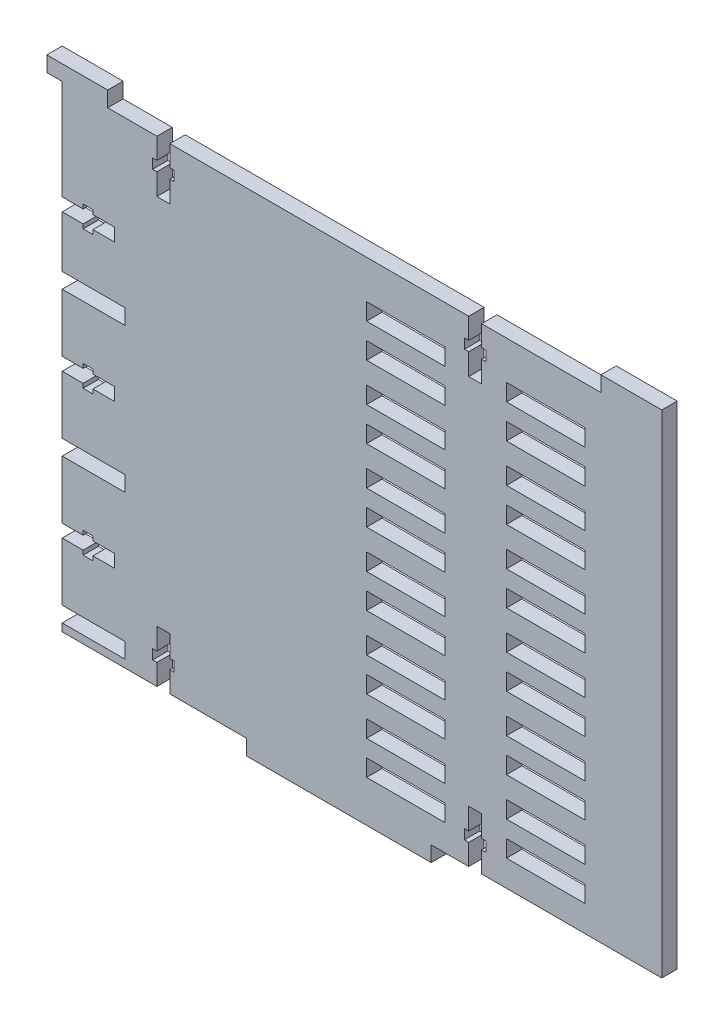
from build123d import *

# Parameters (mm, degrees)
SKETCH1_W           = 25.5
SKETCH1_H           = 5.5
BOSS_EXTRUDE1_DEPTH = 5
CUT_EXTRUDE3_DEPTH  = 10
SKETCH5_W           = 60
SKETCH5_H           = 5
BOSS_EXTRUDE2_DEPTH = 5
SKETCH6_W           = 20.4
SKETCH6_H           = 5
CUT_EXTRUDE4_DEPTH  = 10


with BuildPart() as part:
    # Sketch1 → Boss-Extrude1 (new body)
    with BuildSketch(Plane.XY):
        Polygon((-155.2, 151.5), (-155.2, 146.5), (5.2, 146.5), (5.2, 151.5), (25, 151.5), (25, -8.5), (-170, -8.5), (-170, -6), (-150, -6), (-150, -1), (-170, -1), (-170, 17.9), (-163.2, 17.9), (-163.2, 16.5), (-160, 16.5), (-160, 17.9), (-153, 17.9), (-153, 22.1), (-160, 22.1), (-160, 23.5), (-163.2, 23.5), (-163.2, 22.1), (-170, 22.1), (-170, 41), (-150, 41), (-150, 46), (-170, 46), (-170, 64.9), (-163.2, 64.9), (-163.2, 63.5), (-160, 63.5), (-160, 64.9), (-153, 64.9), (-153, 69.1), (-160, 69.1), (-160, 70.5), (-163.2, 70.5), (-163.2, 69.1), (-170, 69.1), (-170, 88), (-150, 88), (-150, 93), (-170, 93), (-170, 109.8), (-163.2, 109.8), (-163.2, 108.4), (-160, 108.4), (-160, 109.8), (-153, 109.8), (-153, 114), (-160, 114), (-160, 115.4), (-163.2, 115.4), (-163.2, 114), (-170, 114), (-170, 146.5), (-175, 146.5), (-175, 151.5), align=None)
        with Locations((-58.25, 13.75)):
            Rectangle(SKETCH1_W, SKETCH1_H, mode=Mode.SUBTRACT)
        with Locations((-12.75, 2.75)):
            Rectangle(SKETCH1_W, SKETCH1_H, mode=Mode.SUBTRACT)
        with Locations((-58.25, 2.75)):
            Rectangle(SKETCH1_W, SKETCH1_H, mode=Mode.SUBTRACT)
        with Locations((-12.75, 13.75)):
            Rectangle(SKETCH1_W, SKETCH1_H, mode=Mode.SUBTRACT)
        with Locations((-12.75, 26.25)):
            Rectangle(SKETCH1_W, SKETCH1_H, mode=Mode.SUBTRACT)
        with Locations((-58.25, 26.25)):
            Rectangle(SKETCH1_W, SKETCH1_H, mode=Mode.SUBTRACT)
        with Locations((-58.25, 37.25)):
            Rectangle(SKETCH1_W, SKETCH1_H, mode=Mode.SUBTRACT)
        with Locations((-12.75, 37.25)):
            Rectangle(SKETCH1_W, SKETCH1_H, mode=Mode.SUBTRACT)
        with Locations((-12.75, 49.75)):
            Rectangle(SKETCH1_W, SKETCH1_H, mode=Mode.SUBTRACT)
        with Locations((-58.25, 49.75)):
            Rectangle(SKETCH1_W, SKETCH1_H, mode=Mode.SUBTRACT)
        with Locations((-58.25, 60.75)):
            Rectangle(SKETCH1_W, SKETCH1_H, mode=Mode.SUBTRACT)
        with Locations((-12.75, 60.75)):
            Rectangle(SKETCH1_W, SKETCH1_H, mode=Mode.SUBTRACT)
        with Locations((-12.75, 73.25)):
            Rectangle(SKETCH1_W, SKETCH1_H, mode=Mode.SUBTRACT)
        with Locations((-58.25, 73.25)):
            Rectangle(SKETCH1_W, SKETCH1_H, mode=Mode.SUBTRACT)
        with Locations((-58.25, 84.25)):
            Rectangle(SKETCH1_W, SKETCH1_H, mode=Mode.SUBTRACT)
        with Locations((-12.75, 84.25)):
            Rectangle(SKETCH1_W, SKETCH1_H, mode=Mode.SUBTRACT)
        with Locations((-12.75, 96.75)):
            Rectangle(SKETCH1_W, SKETCH1_H, mode=Mode.SUBTRACT)
        with Locations((-58.25, 96.75)):
            Rectangle(SKETCH1_W, SKETCH1_H, mode=Mode.SUBTRACT)
        with Locations((-58.25, 107.75)):
            Rectangle(SKETCH1_W, SKETCH1_H, mode=Mode.SUBTRACT)
        with Locations((-12.75, 107.75)):
            Rectangle(SKETCH1_W, SKETCH1_H, mode=Mode.SUBTRACT)
        with Locations((-12.75, 120.25)):
            Rectangle(SKETCH1_W, SKETCH1_H, mode=Mode.SUBTRACT)
        with Locations((-58.25, 120.25)):
            Rectangle(SKETCH1_W, SKETCH1_H, mode=Mode.SUBTRACT)
        with Locations((-58.25, 131.25)):
            Rectangle(SKETCH1_W, SKETCH1_H, mode=Mode.SUBTRACT)
        with Locations((-12.75, 131.25)):
            Rectangle(SKETCH1_W, SKETCH1_H, mode=Mode.SUBTRACT)
    extrude(amount=BOSS_EXTRUDE1_DEPTH)

    # Sketch4 → Cut-Extrude3 (cut)
    with BuildSketch(Plane.XY.offset(5)):
        Polygon((-33.6, 146.5), (-33.6, 139.7), (-32.2, 139.7), (-32.2, 136.5), (-33.6, 136.5), (-33.6, 129.5), (-37.8, 129.5), (-37.8, 136.5), (-39.2, 136.5), (-39.2, 139.7), (-37.8, 139.7), (-37.8, 146.5), align=None)
        Polygon((-135, 129.5), (-139.2, 129.5), (-139.2, 136.5), (-140.6, 136.5), (-140.6, 139.7), (-139.2, 139.7), (-139.2, 146.5), (-135, 146.5), (-135, 139.7), (-133.6, 139.7), (-133.6, 136.5), (-135, 136.5), align=None)
        Polygon((-33.6, -8.5), (-37.8, -8.5), (-37.8, -1.7), (-39.2, -1.7), (-39.2, 1.5), (-37.8, 1.5), (-37.8, 8.5), (-33.6, 8.5), (-33.6, 1.5), (-32.2, 1.5), (-32.2, -1.7), (-33.6, -1.7), align=None)
        Polygon((-135, -8.5), (-139.2, -8.5), (-139.2, -1.7), (-140.6, -1.7), (-140.6, 1.5), (-139.2, 1.5), (-139.2, 8.5), (-135, 8.5), (-135, 1.5), (-133.6, 1.5), (-133.6, -1.7), (-135, -1.7), align=None)
    extrude(amount=-CUT_EXTRUDE3_DEPTH, mode=Mode.SUBTRACT)

    # Sketch5 → Boss-Extrude2 (add)
    with BuildSketch(Plane.XY.offset(5)):
        with Locations((-80, -11)):
            Rectangle(SKETCH5_W, SKETCH5_H)
    extrude(amount=-BOSS_EXTRUDE2_DEPTH)

    # Sketch6 → Cut-Extrude4 (cut)
    with BuildSketch(Plane.XY.offset(5)):
        with Locations((-159.8, -3.5)):
            Rectangle(SKETCH6_W, SKETCH6_H)
        with Locations((-159.8, 43.5)):
            Rectangle(SKETCH6_W, SKETCH6_H)
        with Locations((-159.8, 90.5)):
            Rectangle(SKETCH6_W, SKETCH6_H)
    extrude(amount=-CUT_EXTRUDE4_DEPTH, mode=Mode.SUBTRACT)


solid = part.part
